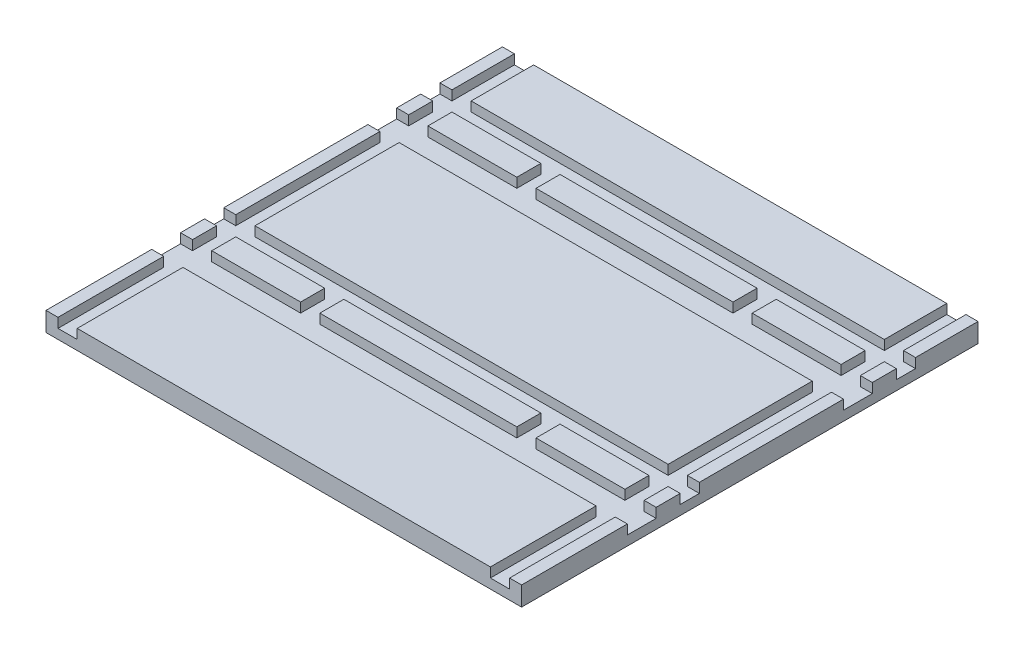
from build123d import *

# Parameters (mm, degrees)
SKETCH2_W           = 120.65
SKETCH2_H           = 120.65
BOSS_EXTRUDE1_DEPTH = 2.54
SKETCH3_W           = 23.495
SKETCH3_H           = 6.35
SKETCH3_W_2         = 52.07
SKETCH3_W_3         = 109.22
SKETCH3_H_2         = 27.94
SKETCH3_W_4         = 0.635
SKETCH3_H_3         = 38.1
SKETCH3_H_4         = 16.51
BOSS_EXTRUDE2_DEPTH = 2.54
BOSS_EXTRUDE4_DEPTH = 2.54


with BuildPart() as part:
    # Sketch2 → Boss-Extrude1 (new body)
    with BuildSketch(Plane(origin=(0, 0, 0), x_dir=(1, 0, 0), z_dir=(0, 1, 0))):
        Rectangle(SKETCH2_W, SKETCH2_H)
    extrude(amount=BOSS_EXTRUDE1_DEPTH)

    # Sketch3 → Boss-Extrude2 (add)
    with BuildSketch(Plane(origin=(0, 2.54, 0), x_dir=(1, 0, 0), z_dir=(0, 1, 0))):
        with Locations((-42.8625, -21.59)):
            Rectangle(SKETCH3_W, SKETCH3_H)
        with Locations((0, -21.59)):
            Rectangle(SKETCH3_W_2, SKETCH3_H)
        with Locations((42.8625, -21.59)):
            Rectangle(SKETCH3_W, SKETCH3_H)
        with Locations((0, -46.355)):
            Rectangle(SKETCH3_W_3, SKETCH3_H_2)
        with Locations((-60.0075, 5.715)):
            Rectangle(SKETCH3_W_4, SKETCH3_H_3)
        with Locations((-60.0075, 35.56)):
            Rectangle(SKETCH3_W_4, SKETCH3_H)
        with Locations((-60.0075, 52.07)):
            Rectangle(SKETCH3_W_4, SKETCH3_H_4)
        with Locations((60.0075, 52.07)):
            Rectangle(SKETCH3_W_4, SKETCH3_H_4)
        with Locations((60.0075, 35.56)):
            Rectangle(SKETCH3_W_4, SKETCH3_H)
        with Locations((60.0075, 5.715)):
            Rectangle(SKETCH3_W_4, SKETCH3_H_3)
        with Locations((-60.0075, -21.59)):
            Rectangle(SKETCH3_W_4, SKETCH3_H)
        with Locations((60.0075, -21.59)):
            Rectangle(SKETCH3_W_4, SKETCH3_H)
        with Locations((60.0075, -46.355)):
            Rectangle(SKETCH3_W_4, SKETCH3_H_2)
        with Locations((-60.0075, -46.355)):
            Rectangle(SKETCH3_W_4, SKETCH3_H_2)
        with Locations((-42.8625, 35.56)):
            Rectangle(SKETCH3_W, SKETCH3_H)
        with Locations((0, 35.56)):
            Rectangle(SKETCH3_W_2, SKETCH3_H)
        with Locations((42.8625, 35.56)):
            Rectangle(SKETCH3_W, SKETCH3_H)
        with Locations((0, 52.07)):
            Rectangle(SKETCH3_W_3, SKETCH3_H_4)
        with Locations((0, 5.715)):
            Rectangle(SKETCH3_W_3, SKETCH3_H_3)
    extrude(amount=BOSS_EXTRUDE2_DEPTH)

    # Sketch5 → Boss-Extrude4 (add)
    with BuildSketch(Plane(origin=(60.325, 0, 0), x_dir=(0, 0, -1), z_dir=(1, 0, 0))):
        Polygon((-60.325, 0), (60.325, 0), (60.325, 5.08), (43.815, 5.08), (43.815, 2.54), (38.735, 2.54), (38.735, 5.08), (32.385, 5.08), (32.385, 2.54), (24.765, 2.54), (24.765, 5.08), (-13.335, 5.08), (-13.335, 2.54), (-18.415, 2.54), (-18.415, 5.08), (-24.765, 5.08), (-24.765, 2.54), (-32.385, 2.54), (-32.385, 5.08), (-60.325, 5.08), align=None)
    boss_extrude4 = extrude(amount=BOSS_EXTRUDE4_DEPTH)

    # Mirror2: Boss-Extrude4 across plane
    add(boss_extrude4.mirror(Plane(origin=(0, 0, 0), x_dir=(0, 0, 1), z_dir=(1, 0, 0))))


solid = part.part
